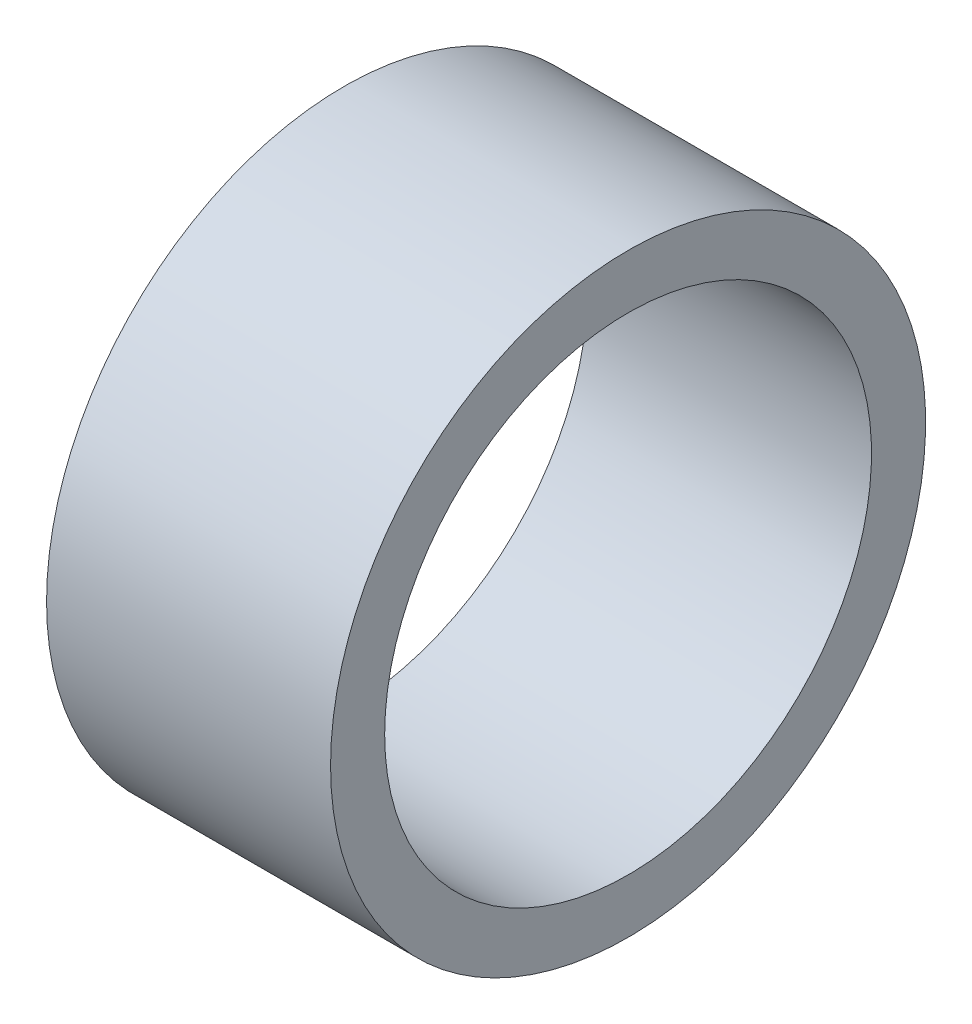
from build123d import *

# Parameters (mm, degrees)
ESQUISSE1_W = 21
ESQUISSE1_H = 4


with BuildPart() as part:
    # Esquisse1 → Révolution1 (revolve)
    with BuildSketch(Plane(origin=(0, 0, 0), x_dir=(-1, 0, 0), z_dir=(0, 0, -1)), mode=Mode.PRIVATE) as r_volution1_sk:
        with Locations((-10.5, 20)):
            Rectangle(ESQUISSE1_W, ESQUISSE1_H)
    revolve(r_volution1_sk.sketch.rotate(Axis((21, 0, 0), (-1, 0, 0)), 270), axis=Axis((21, 0, 0), (-1, 0, 0)))


solid = part.part
